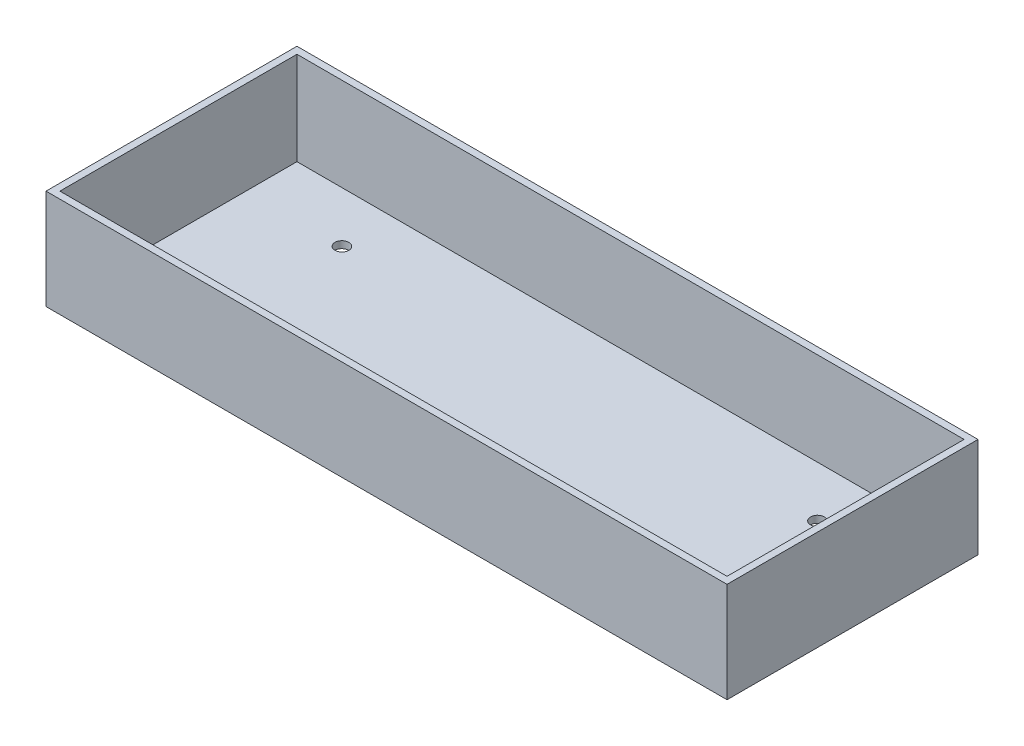
from build123d import *

# Parameters (mm, degrees)
ESQUISSE1_W        = 196.2
ESQUISSE1_H        = 72.3
ESQUISSE1_W_2      = 192.2
ESQUISSE1_H_2      = 68.3
BOSS_EXTRU_1_DEPTH = 28.8
ESQUISSE1_3_W      = 192.2
ESQUISSE1_3_H      = 68.3
ESQUISSE1_3_R      = 2
BOSS_EXTRU_2_DEPTH = 2


with BuildPart() as part:
    # Esquisse1 → Boss.-Extru.1 (new body)
    with BuildSketch(Plane(origin=(0, 0, 0), x_dir=(1, 0, 0), z_dir=(0, 1, 0))):
        with Locations((98.1, 36.15)):
            Rectangle(ESQUISSE1_W, ESQUISSE1_H)
        with Locations((98.1, 36.15)):
            Rectangle(ESQUISSE1_W_2, ESQUISSE1_H_2, mode=Mode.SUBTRACT)
    extrude(amount=BOSS_EXTRU_1_DEPTH)

    # Esquisse1<3> → Boss.-Extru.2 (add)
    with BuildSketch(Plane(origin=(0, 0, 0), x_dir=(1, 0, 0), z_dir=(0, 1, 0))):
        with Locations((98.1, 36.15)):
            Rectangle(ESQUISSE1_3_W, ESQUISSE1_3_H)
        with Locations(Location((29.6, 55.65, 0), (0, 0, 270))):
            Circle(ESQUISSE1_3_R, mode=Mode.SUBTRACT)
        with Locations(Location((29.6, 16.65, 0), (0, 0, 90))):
            Circle(ESQUISSE1_3_R, mode=Mode.SUBTRACT)
        with Locations(Location((166.6, 55.65, 0), (0, 0, 90))):
            Circle(ESQUISSE1_3_R, mode=Mode.SUBTRACT)
        with Locations(Location((166.6, 16.65, 0), (0, 0, 270))):
            Circle(ESQUISSE1_3_R, mode=Mode.SUBTRACT)
    extrude(amount=BOSS_EXTRU_2_DEPTH)


solid = part.part
